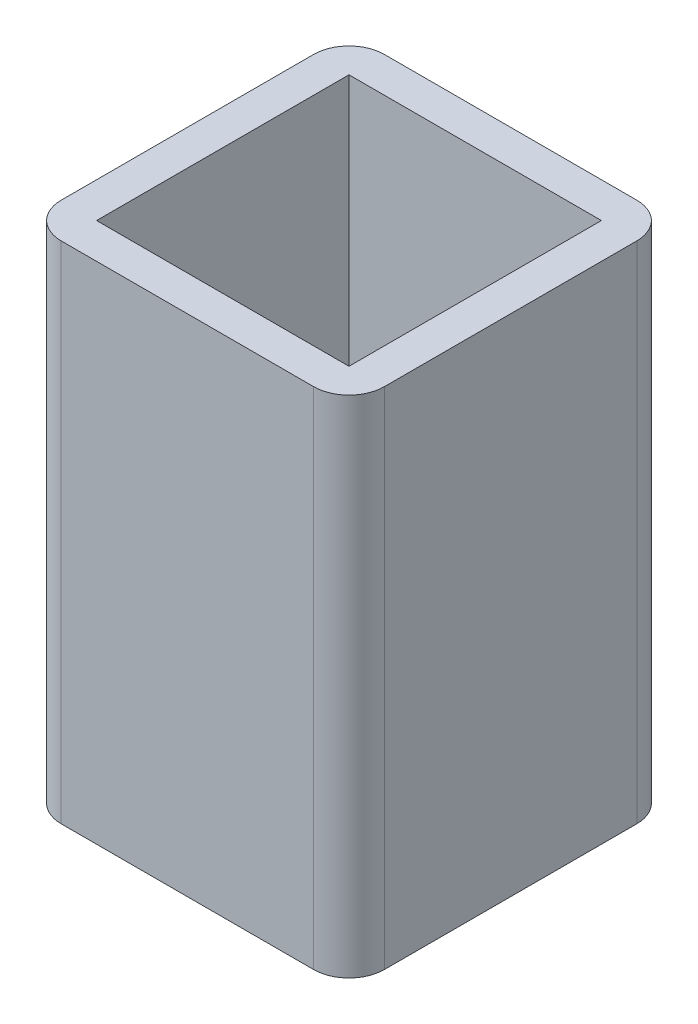
from build123d import *

# Parameters (mm, degrees)
BOSS_EXTRUDE1_DEPTH = 40
SKETCH3_W           = 20
SKETCH3_H           = 20
CUT_EXTRUDE1_DEPTH  = 1040.5


with BuildPart() as part:
    # Sketch1 → Boss-Extrude1 (new body)
    with BuildSketch(Plane(origin=(0, 0, 0), x_dir=(1, 0, 0), z_dir=(0, 1, 0))):
        with BuildLine():
            Line((2.8, 0), (22.8, 0))
            ThreePointArc((22.8, 0), (24.779898987, -0.820101013), (25.6, -2.8))
            Line((25.6, -2.8), (25.6, -22.8))
            ThreePointArc((25.6, -22.8), (24.779898987, -24.779898987), (22.8, -25.6))
            Line((22.8, -25.6), (2.8, -25.6))
            ThreePointArc((2.8, -25.6), (0.820101013, -24.779898987), (0, -22.8))
            Line((0, -22.8), (0, -2.8))
            ThreePointArc((0, -2.8), (0.820101013, -0.820101013), (2.8, 0))
        make_face()
    extrude(amount=BOSS_EXTRUDE1_DEPTH)

    # Sketch3 → Cut-Extrude1 (cut)
    with BuildSketch(Plane(origin=(0, 0, 0), x_dir=(-1, 0, 0), z_dir=(0, -1, 0))):
        with Locations((-12.8, -12.8)):
            Rectangle(SKETCH3_W, SKETCH3_H)
    extrude(amount=-CUT_EXTRUDE1_DEPTH, mode=Mode.SUBTRACT)


solid = part.part
